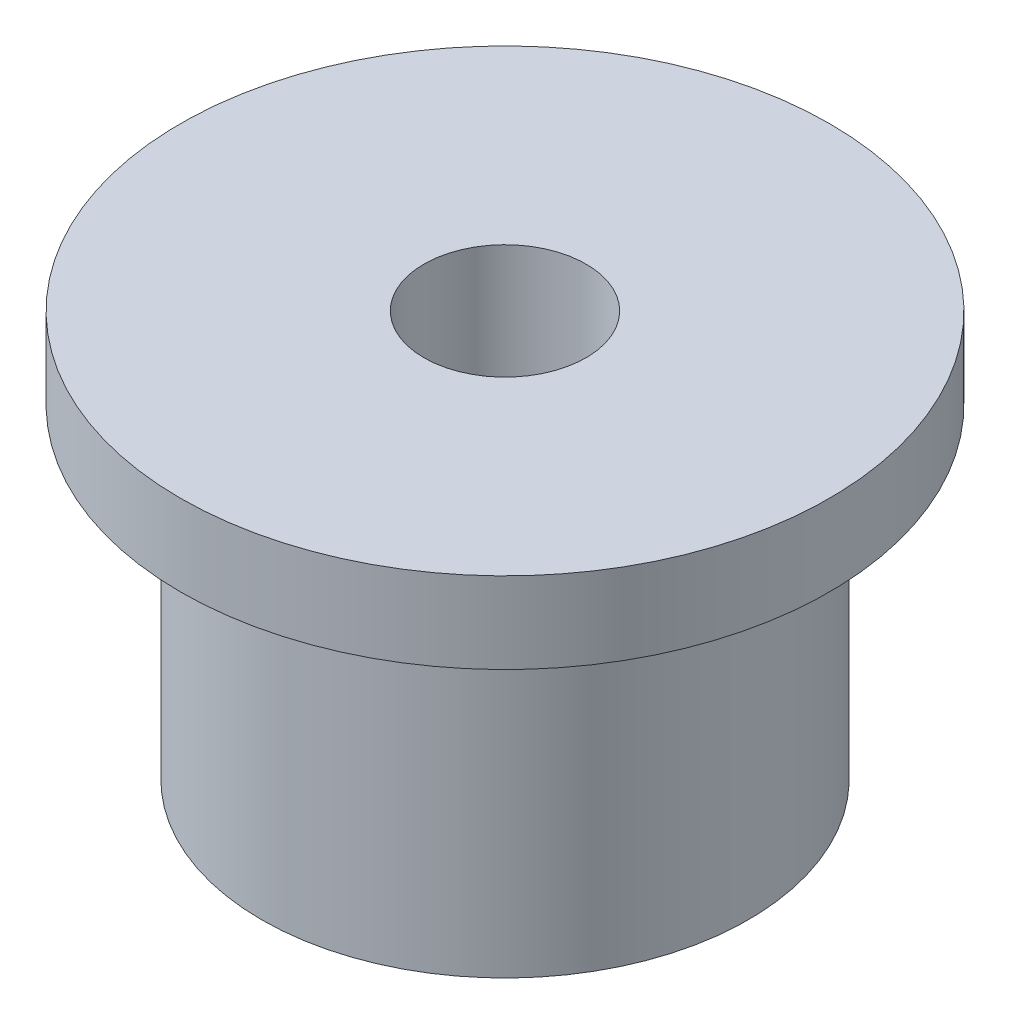
from build123d import *

# Parameters (mm, degrees)
SKETCH2_R           = 19.05
SKETCH2_R_2         = 6.35
BOSS_EXTRUDE1_DEPTH = 25.4
SKETCH3_R           = 25.4
SKETCH3_R_2         = 6.35
BOSS_EXTRUDE3_DEPTH = 6.35


with BuildPart() as part:
    # Sketch2 → Boss-Extrude1 (new body)
    with BuildSketch(Plane(origin=(0, 0, 0), x_dir=(1, 0, 0), z_dir=(0, 1, 0))):
        with Locations(Location((0.838582421, 0, 0), (0, 0, 270))):
            Circle(SKETCH2_R)
        with Locations(Location((0.838582421, 0, 0), (0, 0, 270))):
            Circle(SKETCH2_R_2, mode=Mode.SUBTRACT)
    extrude(amount=BOSS_EXTRUDE1_DEPTH)

    # Sketch3 → Boss-Extrude3 (add)
    with BuildSketch(Plane(origin=(0, 25.4, 0), x_dir=(1, 0, 0), z_dir=(0, 1, 0))):
        with Locations(Location((0.838582421, 0, 0), (0, 0, 270))):
            Circle(SKETCH3_R)
        with Locations(Location((0.838582421, 0, 0), (0, 0, 270))):
            Circle(SKETCH3_R_2, mode=Mode.SUBTRACT)
    extrude(amount=BOSS_EXTRUDE3_DEPTH)


solid = part.part
